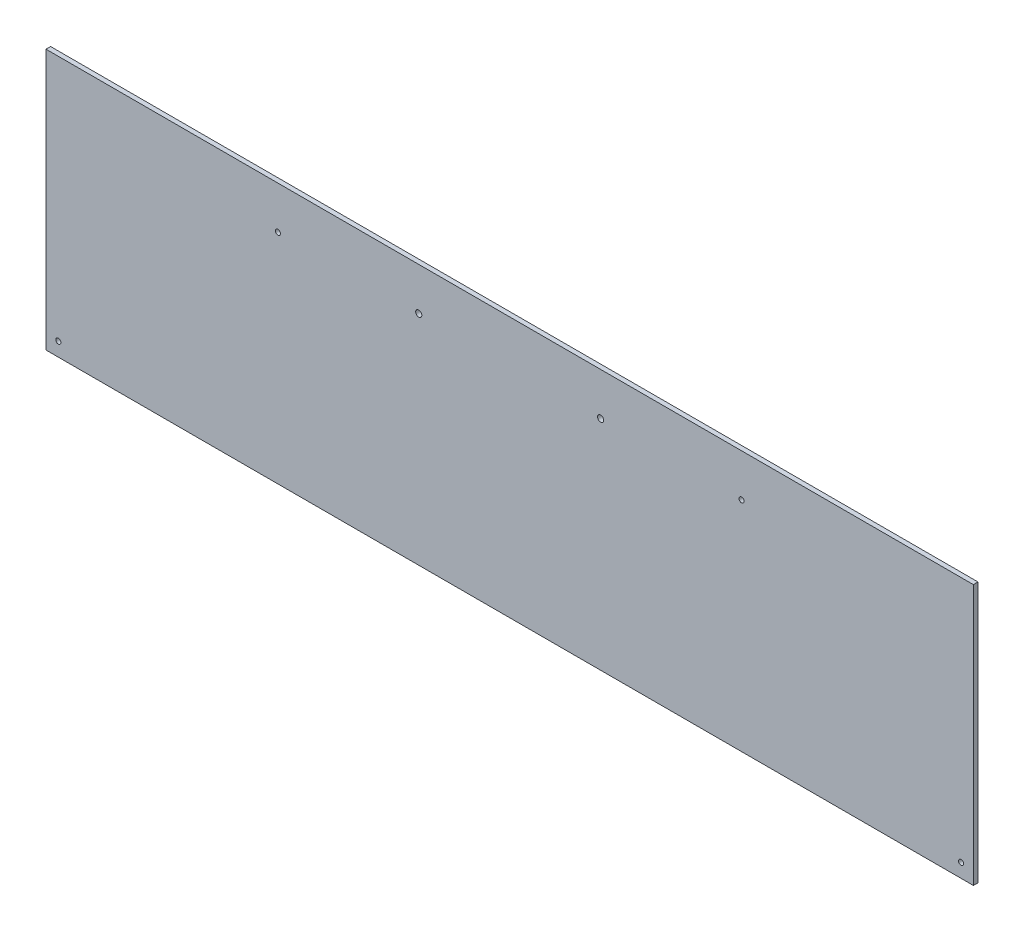
from build123d import *

# Parameters (mm, degrees)
SKETCH1_R           = 2.5
SKETCH1_R_2         = 3
BOSS_EXTRUDE1_DEPTH = 4.5


with BuildPart() as part:
    # Sketch1 → Boss-Extrude1 (new body)
    with BuildSketch(Plane.XY):
        Polygon((-452, 118.5), (-452, -135.5), (452, -135.5), (452, 118.5), (228.5, 118.5), (223.5, 118.5), (2.5, 118.5), (-2.5, 118.5), (-223.5, 118.5), (-228.5, 118.5), align=None)
        with Locations((440, -122)):
            Circle(SKETCH1_R, mode=Mode.SUBTRACT)
        with Locations((-440, -122)):
            Circle(SKETCH1_R, mode=Mode.SUBTRACT)
        with Locations((-226, 77)):
            Circle(SKETCH1_R, mode=Mode.SUBTRACT)
        with Locations(Location((226, 77, 0), (0, 0, 180))):
            Circle(SKETCH1_R, mode=Mode.SUBTRACT)
        with Locations((-88.617163414, 77)):
            Circle(SKETCH1_R_2, mode=Mode.SUBTRACT)
        with Locations(Location((88.617163414, 77, 0), (0, 0, 180))):
            Circle(SKETCH1_R_2, mode=Mode.SUBTRACT)
    extrude(amount=BOSS_EXTRUDE1_DEPTH)


solid = part.part
